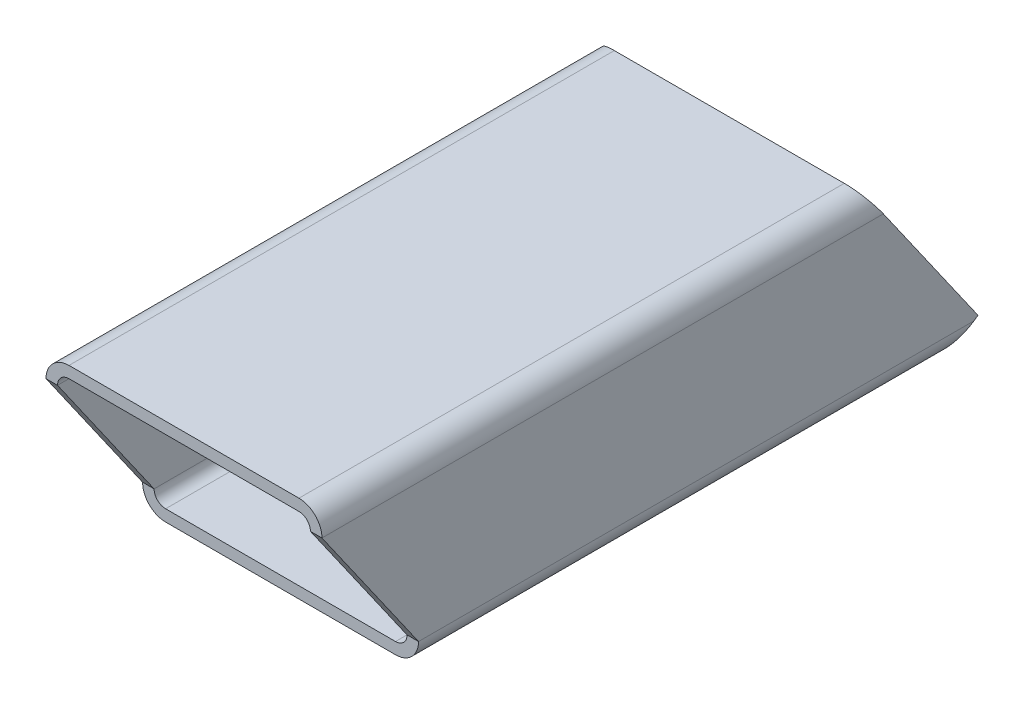
from build123d import *

# Parameters (mm, degrees)
BOSS_EXTRUDE1_DEPTH     = 215.9
CUT_EXTRUDE1_DEPTH      = 235.52055347
CUT_EXTRUDE1_DEPTH_BACK = 235.52055347
CUT_EXTRUDE2_DEPTH      = 235.52055347
CUT_EXTRUDE2_DEPTH_BACK = 235.52055347
CUT_EXTRUDE3_DEPTH      = 267.567675507
CUT_EXTRUDE3_DEPTH_BACK = 267.567675507


with BuildPart() as part:
    # Sketch1 → Boss-Extrude1 (new, symmetric)
    with BuildSketch(Plane.XY):
        with BuildLine():
            Line((-63.5, -50.8), (63.5, -50.8))
            ThreePointArc((63.5, -50.8), (72.480256121, -47.080256121), (76.2, -38.1))
            Line((76.2, -38.1), (76.2, 38.1))
            ThreePointArc((76.2, 38.1), (72.480256121, 47.080256121), (63.5, 50.8))
            Line((63.5, 50.8), (-63.5, 50.8))
            ThreePointArc((-63.5, 50.8), (-72.480256121, 47.080256121), (-76.2, 38.1))
            Line((-76.2, 38.1), (-76.2, -38.1))
            ThreePointArc((-76.2, -38.1), (-72.480256121, -47.080256121), (-63.5, -50.8))
        make_face()
        with BuildLine():
            Line((-63.5, 44.45), (63.5, 44.45))
            ThreePointArc((63.5, 44.45), (67.990128061, 42.590128061), (69.85, 38.1))
            Line((69.85, 38.1), (69.85, -38.1))
            ThreePointArc((69.85, -38.1), (67.990128061, -42.590128061), (63.5, -44.45))
            Line((63.5, -44.45), (-63.5, -44.45))
            ThreePointArc((-63.5, -44.45), (-67.990128061, -42.590128061), (-69.85, -38.1))
            Line((-69.85, -38.1), (-69.85, 38.1))
            ThreePointArc((-69.85, 38.1), (-67.990128061, 42.590128061), (-63.5, 44.45))
        make_face(mode=Mode.SUBTRACT)
    extrude(amount=BOSS_EXTRUDE1_DEPTH, both=True)

    # Sketch2 → Cut-Extrude1 (cut, two sides: drawn at the far end of the back side and taken through both)
    with BuildSketch(Plane(origin=(0, 0, 0), x_dir=(0, 0, -1), z_dir=(1, 0, 0)).offset(-CUT_EXTRUDE1_DEPTH_BACK)):
        Polygon((-215.9, 50.8), (-215.9, -50.8), (-159.369185588, -50.8), (-159.369185588, -38.1), (-212.725, 38.1), (-212.725, 50.8), align=None)
    extrude(amount=CUT_EXTRUDE1_DEPTH + CUT_EXTRUDE1_DEPTH_BACK, mode=Mode.SUBTRACT)

    # Sketch3 → Cut-Extrude2 (cut, two sides: drawn at the far end of the back side and taken through both)
    with BuildSketch(Plane(origin=(0, 0, 0), x_dir=(0, 0, -1), z_dir=(1, 0, 0)).offset(-CUT_EXTRUDE2_DEPTH_BACK)):
        Polygon((70.328712905, 76.692890201), (278.875695835, 76.692890201), (278.875695835, -66.353510659), (183.855194167, -85.439727725), align=None)
    extrude(amount=CUT_EXTRUDE2_DEPTH + CUT_EXTRUDE2_DEPTH_BACK, mode=Mode.SUBTRACT)

    # Sketch4 → Cut-Extrude3 (cut, two sides: drawn at the far end of the back side and taken through both)
    with BuildSketch(Plane(origin=(76.2, 0, 0), x_dir=(0, 0, -1), z_dir=(1, 0, 0)).offset(-CUT_EXTRUDE3_DEPTH_BACK)):
        Polygon((51.667098459, -105.135311235), (172.443519022, -20.566751119), (188.243794301, -73.434684409), align=None)
    extrude(amount=CUT_EXTRUDE3_DEPTH + CUT_EXTRUDE3_DEPTH_BACK, mode=Mode.SUBTRACT)


solid = part.part
